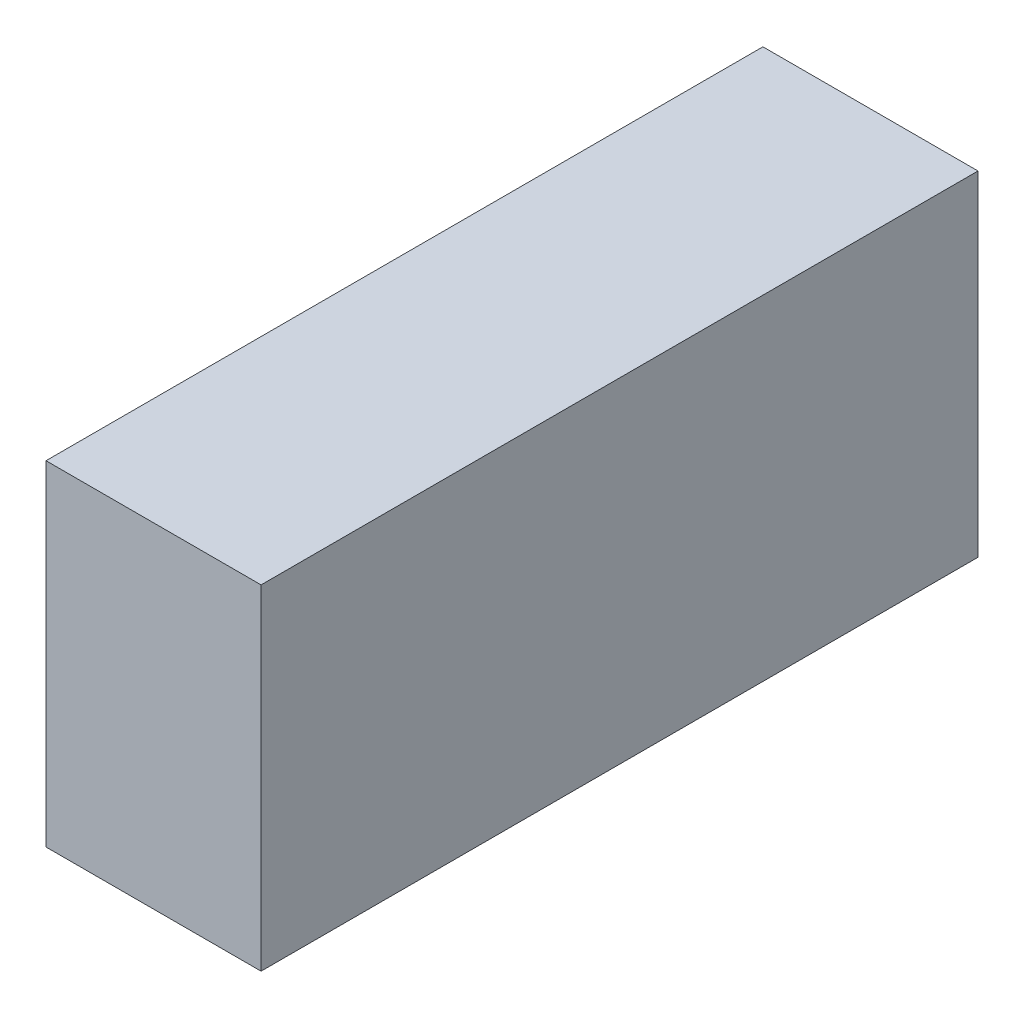
from build123d import *

# Parameters (mm, degrees)
SKETCH1_W           = 1.8
SKETCH1_H           = 2.8
BOSS_EXTRUDE1_DEPTH = 6


with BuildPart() as part:
    # Sketch1 → Boss-Extrude1 (new body)
    with BuildSketch(Plane.XY):
        Rectangle(SKETCH1_W, SKETCH1_H)
    extrude(amount=BOSS_EXTRUDE1_DEPTH)


solid = part.part
